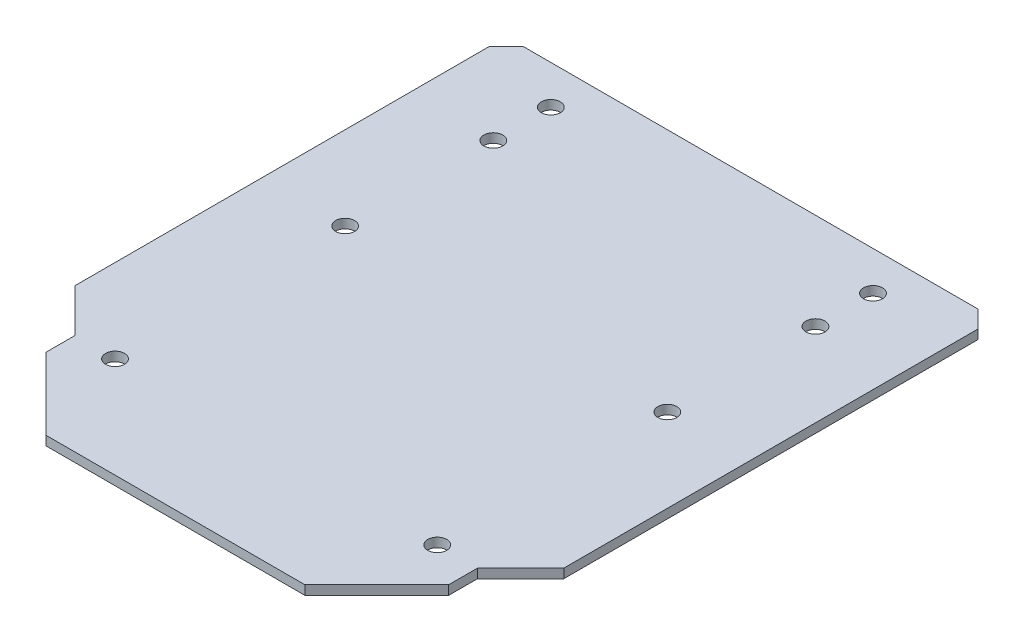
from build123d import *

# Parameters (mm, degrees)
SKETCH_1_W          = 85
SKETCH_1_H          = 75
EXTRUDE_1_DEPTH     = 1.6
CUT_EXTRUDE_1_REACH = 58.701
SKETCH_2_R          = 1.65
SKETCH_8_W          = 85
SKETCH_8_H          = 25
EXTRUDE_3_DEPTH     = 1.6
CHAMFER_2_SIZE      = 3
CHAMFER_3_SIZE      = 20
CUT_EXTRUDE_4_REACH = 77.598
CUT_EXTRUDE_5_REACH = 77.598
SKETCH_9_R          = 1.65


with BuildPart() as part:
    # 草图1 → 凸台-拉伸1 (new body)
    with BuildSketch(Plane(origin=(0, 0, 0), x_dir=(1, 0, 0), z_dir=(0, 1, 0))):
        Rectangle(SKETCH_1_W, SKETCH_1_H)
    extrude(amount=EXTRUDE_1_DEPTH)

    # 草图2 → 切除-拉伸1 (cut, up to next)
    with BuildSketch(Plane(origin=(0, 1.6, 0), x_dir=(1, 0, 0), z_dir=(0, 1, 0)), mode=Mode.PRIVATE) as cut_extrude_1_sk1:
        with Locations(Location((-28, 20, 0), (0, 0, 270))):
            Circle(SKETCH_2_R)
    cut_extrude_1_tool1 = extrude(cut_extrude_1_sk1.sketch, amount=-CUT_EXTRUDE_1_REACH, mode=Mode.PRIVATE) & part.part
    # 草图2 → 切除-拉伸1 (cut, up to next)
    with BuildSketch(Plane(origin=(0, 1.6, 0), x_dir=(1, 0, 0), z_dir=(0, 1, 0)), mode=Mode.PRIVATE) as cut_extrude_1_sk2:
        with Locations(Location((-28, -20, 0), (0, 0, 270))):
            Circle(SKETCH_2_R)
    cut_extrude_1_tool2 = extrude(cut_extrude_1_sk2.sketch, amount=-CUT_EXTRUDE_1_REACH, mode=Mode.PRIVATE) & part.part
    # 草图2 → 切除-拉伸1 (cut, up to next)
    with BuildSketch(Plane(origin=(0, 1.6, 0), x_dir=(1, 0, 0), z_dir=(0, 1, 0)), mode=Mode.PRIVATE) as cut_extrude_1_sk3:
        with Locations(Location((28, 20, 0), (0, 0, 270))):
            Circle(SKETCH_2_R)
    cut_extrude_1_tool3 = extrude(cut_extrude_1_sk3.sketch, amount=-CUT_EXTRUDE_1_REACH, mode=Mode.PRIVATE) & part.part
    # 草图2 → 切除-拉伸1 (cut, up to next)
    with BuildSketch(Plane(origin=(0, 1.6, 0), x_dir=(1, 0, 0), z_dir=(0, 1, 0)), mode=Mode.PRIVATE) as cut_extrude_1_sk4:
        with Locations(Location((28, -20, 0), (0, 0, 270))):
            Circle(SKETCH_2_R)
    cut_extrude_1_tool4 = extrude(cut_extrude_1_sk4.sketch, amount=-CUT_EXTRUDE_1_REACH, mode=Mode.PRIVATE) & part.part
    add(cut_extrude_1_tool1.solids().sort_by_distance((-28, 1.6, -20))[0], mode=Mode.SUBTRACT)
    add(cut_extrude_1_tool2.solids().sort_by_distance((-28, 1.6, 20))[0], mode=Mode.SUBTRACT)
    add(cut_extrude_1_tool3.solids().sort_by_distance((28, 1.6, -20))[0], mode=Mode.SUBTRACT)
    add(cut_extrude_1_tool4.solids().sort_by_distance((28, 1.6, 20))[0], mode=Mode.SUBTRACT)

    # 草图8 → 凸台-拉伸3 (add)
    with BuildSketch(Plane(origin=(0, 0, 0), x_dir=(1, 0, 0), z_dir=(0, 1, 0))):
        with Locations((0, 50)):
            Rectangle(SKETCH_8_W, SKETCH_8_H)
    extrude(amount=EXTRUDE_3_DEPTH)

    # 倒角2
    chamfer_2_edges = [part.edges().sort_by_distance(p)[0] for p in [
        (42.5, 0.8, -62.5),
        (-42.5, 0.8, -62.5),
    ]]
    chamfer(chamfer_2_edges, length=CHAMFER_2_SIZE)

    # 倒角3
    chamfer_3_edges = [part.edges().sort_by_distance(p)[0] for p in [
        (42.5, 0.8, 37.5),
        (-42.5, 0.8, 37.5),
    ]]
    chamfer(chamfer_3_edges, length=CHAMFER_3_SIZE)

    # 草图7 → 切除-拉伸4 (cut, up to next)
    with BuildSketch(Plane(origin=(0, 1.6, 0), x_dir=(1, 0, 0), z_dir=(0, 1, 0)), mode=Mode.PRIVATE) as cut_extrude_4_sk1:
        Polygon((-35, -25), (-35, -20), (-42.5, -12.5), (-42.5, -17.5), align=None)
    cut_extrude_4_tool1 = extrude(cut_extrude_4_sk1.sketch, amount=-CUT_EXTRUDE_4_REACH, mode=Mode.PRIVATE) & part.part
    cut_extrude_4 = cut_extrude_4_tool1.solids().sort_by_distance((-38.75, 1.6, 18.75))[0]
    add(cut_extrude_4, mode=Mode.SUBTRACT)

    # 镜向1: 切除-拉伸4 across plane
    add(cut_extrude_4.mirror(Plane(origin=(0, 0, 0), x_dir=(0, 0, 1), z_dir=(1, 0, 0))), mode=Mode.SUBTRACT)

    # 草图9 → 切除-拉伸5 (cut, up to next)
    with BuildSketch(Plane(origin=(0, 1.6, 0), x_dir=(1, 0, 0), z_dir=(0, 1, 0)), mode=Mode.PRIVATE) as cut_extrude_5_sk1:
        with Locations(Location((-28, 55.75, 0), (0, 0, 270))):
            Circle(SKETCH_9_R)
    cut_extrude_5_tool1 = extrude(cut_extrude_5_sk1.sketch, amount=-CUT_EXTRUDE_5_REACH, mode=Mode.PRIVATE) & part.part
    # 草图9 → 切除-拉伸5 (cut, up to next)
    with BuildSketch(Plane(origin=(0, 1.6, 0), x_dir=(1, 0, 0), z_dir=(0, 1, 0)), mode=Mode.PRIVATE) as cut_extrude_5_sk2:
        with Locations(Location((-28, 45.75, 0), (0, 0, 270))):
            Circle(SKETCH_9_R)
    cut_extrude_5_tool2 = extrude(cut_extrude_5_sk2.sketch, amount=-CUT_EXTRUDE_5_REACH, mode=Mode.PRIVATE) & part.part
    # 草图9 → 切除-拉伸5 (cut, up to next)
    with BuildSketch(Plane(origin=(0, 1.6, 0), x_dir=(1, 0, 0), z_dir=(0, 1, 0)), mode=Mode.PRIVATE) as cut_extrude_5_sk3:
        with Locations(Location((28, 55.75, 0), (0, 0, 270))):
            Circle(SKETCH_9_R)
    cut_extrude_5_tool3 = extrude(cut_extrude_5_sk3.sketch, amount=-CUT_EXTRUDE_5_REACH, mode=Mode.PRIVATE) & part.part
    # 草图9 → 切除-拉伸5 (cut, up to next)
    with BuildSketch(Plane(origin=(0, 1.6, 0), x_dir=(1, 0, 0), z_dir=(0, 1, 0)), mode=Mode.PRIVATE) as cut_extrude_5_sk4:
        with Locations(Location((28, 45.75, 0), (0, 0, 270))):
            Circle(SKETCH_9_R)
    cut_extrude_5_tool4 = extrude(cut_extrude_5_sk4.sketch, amount=-CUT_EXTRUDE_5_REACH, mode=Mode.PRIVATE) & part.part
    add(cut_extrude_5_tool1.solids().sort_by_distance((-28, 1.6, -55.75))[0], mode=Mode.SUBTRACT)
    add(cut_extrude_5_tool2.solids().sort_by_distance((-28, 1.6, -45.75))[0], mode=Mode.SUBTRACT)
    add(cut_extrude_5_tool3.solids().sort_by_distance((28, 1.6, -55.75))[0], mode=Mode.SUBTRACT)
    add(cut_extrude_5_tool4.solids().sort_by_distance((28, 1.6, -45.75))[0], mode=Mode.SUBTRACT)


solid = part.part
